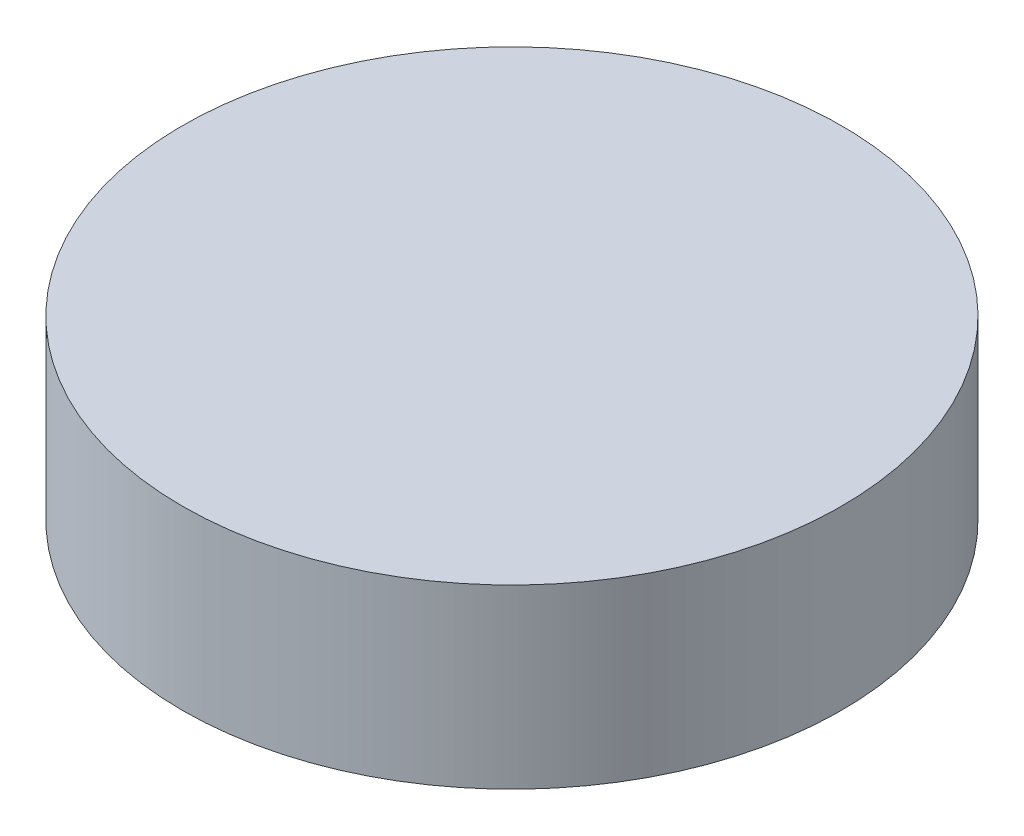
from build123d import *

# Parameters (mm, degrees)
SKETCH1_R           = 14.2
BOSS_EXTRUDE1_DEPTH = 7.62


with BuildPart() as part:
    # Sketch1 → Boss-Extrude1 (new body)
    with BuildSketch(Plane(origin=(0, 0, 0), x_dir=(1, 0, 0), z_dir=(0, 1, 0))):
        with Locations(Location((0, 0, 0), (0, 0, 270))):
            Circle(SKETCH1_R)
    extrude(amount=BOSS_EXTRUDE1_DEPTH)


solid = part.part
